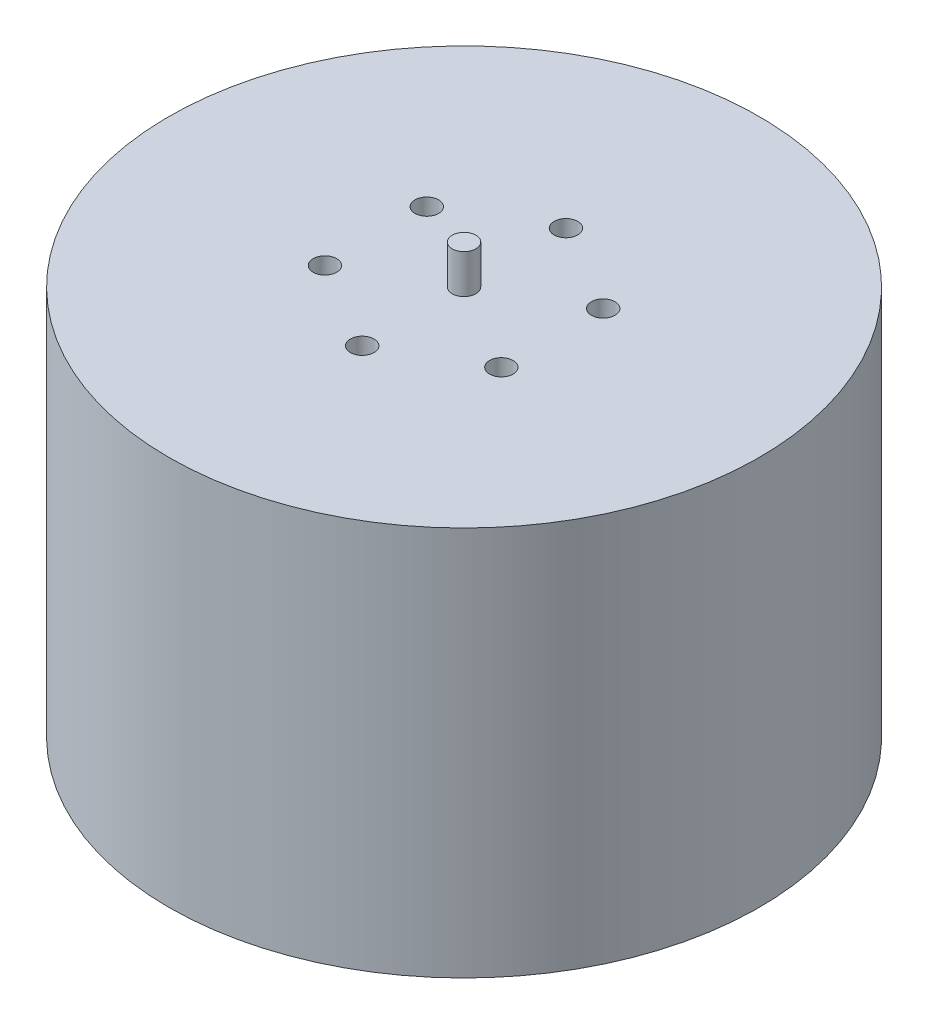
from build123d import *

# Parameters (mm, degrees)
SKETCH_1_R          = 50
EXTRUDE_1_DEPTH     = 66
SKETCH_2_R          = 2
CUT_EXTRUDE_2_DEPTH = 97.726418315
SKETCH_3_R          = 2
EXTRUDE_2_DEPTH     = 6.6
SKETCH_4_R          = 3
CUT_EXTRUDE_3_DEPTH = 6
SKETCH_8_R          = 2
CUT_EXTRUDE_4_DEPTH = 6


with BuildPart() as part:
    # 草图1 → 凸台-拉伸1 (new body)
    with BuildSketch(Plane(origin=(0, 0, 0), x_dir=(1, 0, 0), z_dir=(0, 1, 0))):
        with Locations(Location((0, 0, 0), (0, 0, 270))):
            Circle(SKETCH_1_R)
    extrude(amount=EXTRUDE_1_DEPTH)

    # 草图2 → 切除-拉伸2 (cut, through all)
    with BuildSketch(Plane(origin=(0, 66, 0), x_dir=(1, 0, 0), z_dir=(0, 1, 0))):
        with Locations(Location((0, 17.25, 0), (0, 0, 270))):
            Circle(SKETCH_2_R)
        with Locations(Location((14.938938215, 8.625, 0), (0, 0, 270))):
            Circle(SKETCH_2_R)
        with Locations(Location((14.938938215, -8.625, 0), (0, 0, 270))):
            Circle(SKETCH_2_R)
        with Locations(Location((0, -17.25, 0), (0, 0, 270))):
            Circle(SKETCH_2_R)
        with Locations(Location((-14.938938215, -8.625, 0), (0, 0, 270))):
            Circle(SKETCH_2_R)
        with Locations(Location((-14.938938215, 8.625, 0), (0, 0, 270))):
            Circle(SKETCH_2_R)
    extrude(amount=-CUT_EXTRUDE_2_DEPTH, mode=Mode.SUBTRACT)

    # 草图3 → 凸台-拉伸2 (add)
    with BuildSketch(Plane(origin=(0, 66, 0), x_dir=(1, 0, 0), z_dir=(0, 1, 0))):
        with Locations(Location((0, 0, 0), (0, 0, 270))):
            Circle(SKETCH_3_R)
    extrude(amount=EXTRUDE_2_DEPTH)

    # 草图4 → 切除-拉伸3 (cut)
    with BuildSketch(Plane(origin=(0, 0, 0), x_dir=(-1, 0, 0), z_dir=(0, -1, 0))):
        with Locations(Location((0, 0, 0), (0, 0, 90))):
            Circle(SKETCH_4_R)
    extrude(amount=-CUT_EXTRUDE_3_DEPTH, mode=Mode.SUBTRACT)

    # 草图8 → 切除-拉伸4 (cut)
    with BuildSketch(Plane(origin=(0, 0, 0), x_dir=(-1, 0, 0), z_dir=(0, -1, 0))):
        with Locations(Location((0, 32.222894459, 0), (0, 0, 90))):
            Circle(SKETCH_8_R)
        with Locations(Location((32.222894459, 0, 0), (0, 0, 90))):
            Circle(SKETCH_8_R)
        with Locations(Location((0, -32.222894459, 0), (0, 0, 90))):
            Circle(SKETCH_8_R)
        with Locations(Location((-32.222894459, 0, 0), (0, 0, 90))):
            Circle(SKETCH_8_R)
    extrude(amount=-CUT_EXTRUDE_4_DEPTH, mode=Mode.SUBTRACT)


solid = part.part
